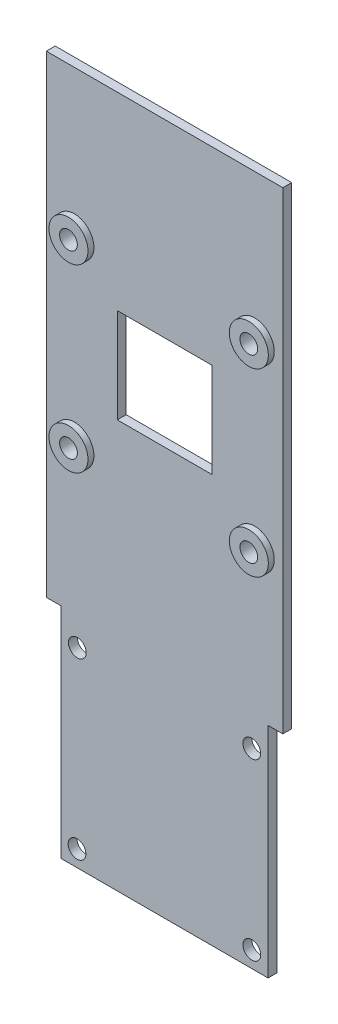
from build123d import *

# Parameters (mm, degrees)
SKETCH_2_R      = 1.5
EXTRUDE_1_DEPTH = 1.5
SKETCH_3_R      = 3.3
SKETCH_3_R_2    = 1.5
EXTRUDE_2_DEPTH = 1


with BuildPart() as part:
    # 草图2 → 凸台-拉伸1 (new body)
    with BuildSketch(Plane.XY):
        Polygon((-7.171063422, 61.18004624), (32.828936578, 61.18004624), (32.828936578, -18.81995376), (30.328936578, -18.81995376), (30.328936578, -55.81995376), (-4.671063422, -55.81995376), (-4.671063422, -18.81995376), (-7.171063422, -18.81995376), align=None)
        with Locations((-2.421063422, 36.43004624)):
            Circle(SKETCH_2_R, mode=Mode.SUBTRACT)
        with Locations(Location((28.078936578, 36.43004624, 0), (0, 0, 180))):
            Circle(SKETCH_2_R, mode=Mode.SUBTRACT)
        with Locations((28.078936578, 5.93004624)):
            Circle(SKETCH_2_R, mode=Mode.SUBTRACT)
        with Locations(Location((-2.421063422, 5.93004624, 0), (0, 0, 180))):
            Circle(SKETCH_2_R, mode=Mode.SUBTRACT)
        with Locations(Location((-1.921063422, -23.56995376, 0), (0, 0, 180))):
            Circle(SKETCH_2_R, mode=Mode.SUBTRACT)
        with Locations(Location((27.578936578, -23.56995376, 0), (0, 0, 180))):
            Circle(SKETCH_2_R, mode=Mode.SUBTRACT)
        with Locations(Location((-1.979146383, -53.06995376, 0), (0, 0, 180))):
            Circle(SKETCH_2_R, mode=Mode.SUBTRACT)
        with Locations(Location((27.578936578, -53.06995376, 0), (0, 0, 180))):
            Circle(SKETCH_2_R, mode=Mode.SUBTRACT)
        Polygon((12.828936578, 13.18004624), (20.828936578, 13.18004624), (20.828936578, 29.18004624), (4.828936578, 29.18004624), (4.828936578, 13.18004624), align=None, mode=Mode.SUBTRACT)
    extrude(amount=EXTRUDE_1_DEPTH)

    # 草图3 → 凸台-拉伸2 (add)
    # profile 1 of 4: a face of its own
    with BuildSketch(Plane.XY.offset(1.5)):
        with Locations((-2.421063422, 36.43004624)):
            Circle(SKETCH_3_R)
        with Locations((-2.421063422, 36.43004624)):
            Circle(SKETCH_3_R_2, mode=Mode.SUBTRACT)
    # profile 2 of 4: a face of its own
    with BuildSketch(Plane.XY.offset(1.5)):
        with Locations((28.078936578, 36.43004624)):
            Circle(SKETCH_3_R)
        with Locations(Location((28.078936578, 36.43004624, 0), (0, 0, 180))):
            Circle(SKETCH_3_R_2, mode=Mode.SUBTRACT)
    # profile 3 of 4: a face of its own
    with BuildSketch(Plane.XY.offset(1.5)):
        with Locations((-2.421063422, 5.93004624)):
            Circle(SKETCH_3_R)
        with Locations(Location((-2.421063422, 5.93004624, 0), (0, 0, 180))):
            Circle(SKETCH_3_R_2, mode=Mode.SUBTRACT)
    # profile 4 of 4: a face of its own
    with BuildSketch(Plane.XY.offset(1.5)):
        with Locations((28.078936578, 5.93004624)):
            Circle(SKETCH_3_R)
        with Locations((28.078936578, 5.93004624)):
            Circle(SKETCH_3_R_2, mode=Mode.SUBTRACT)
    extrude(amount=EXTRUDE_2_DEPTH)


solid = part.part
